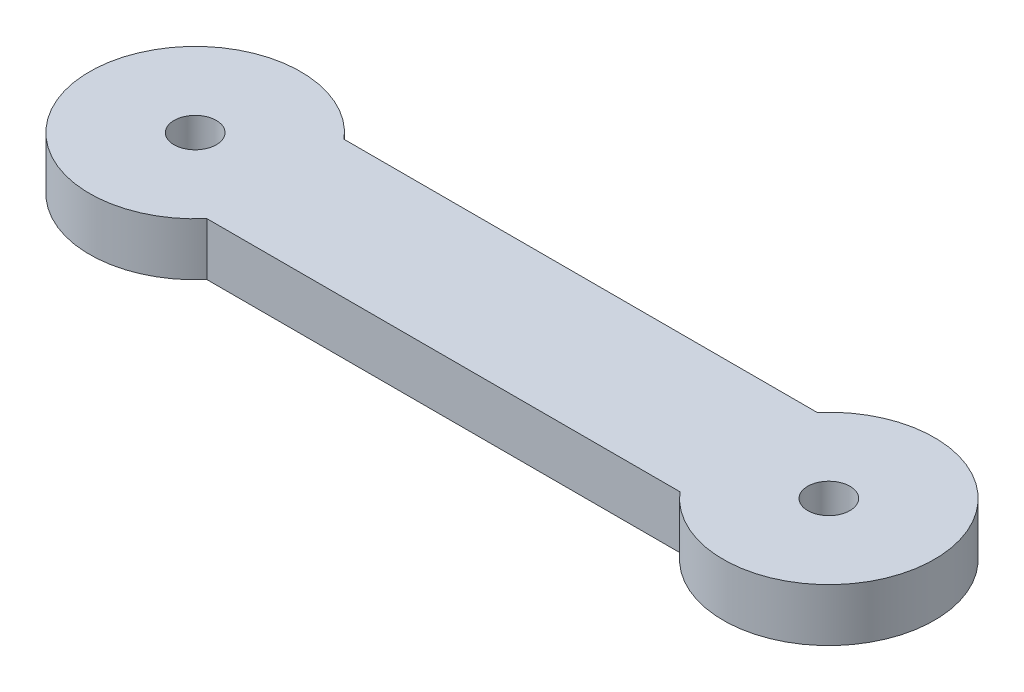
from build123d import *

# Parameters (mm, degrees)
SKIZZE1_R                       = 2
AUFSATZ_LINEAR_AUSTRAGEN1_DEPTH = 5


with BuildPart() as part:
    # Skizze1 → Aufsatz-Linear austragen1 (new body)
    with BuildSketch(Plane(origin=(0, 0, 0), x_dir=(1, 0, 0), z_dir=(0, 1, 0))):
        with BuildLine():
            Line((22.400657923, 6.5), (0, 6.5))
            Line((0, 6.5), (0, -6.5))
            Line((0, -6.5), (22.400657923, -6.5))
            ThreePointArc((22.400657923, -6.5), (40, 0), (22.400657923, 6.5))
        make_face()
        with Locations(Location((30, 0, 0), (0, 0, 270))):
            Circle(SKIZZE1_R, mode=Mode.SUBTRACT)
    aufsatz_linear_austragen1 = extrude(amount=AUFSATZ_LINEAR_AUSTRAGEN1_DEPTH)

    # Spiegeln1: Aufsatz-Linear austragen1 across plane
    add(aufsatz_linear_austragen1.mirror(Plane(origin=(0, 0, 0), x_dir=(0, 0, 1), z_dir=(1, 0, 0))))


solid = part.part
